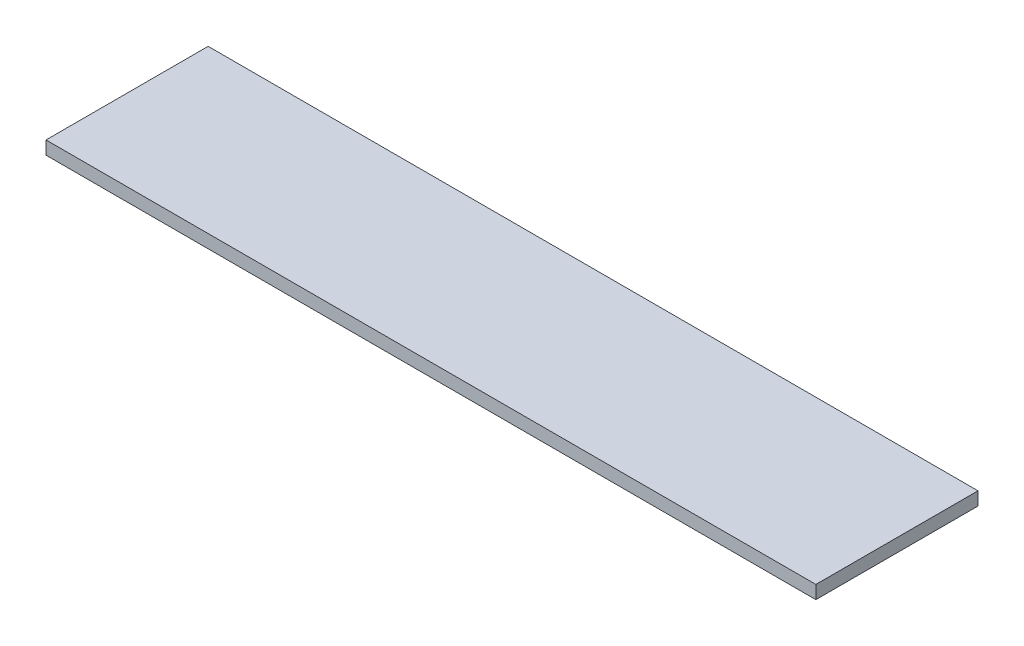
from build123d import *

# Parameters (mm, degrees)
SKETCH_1_W      = 569.770649127
SKETCH_1_H      = 9.782099076
EXTRUDE_1_DEPTH = 120


with BuildPart() as part:
    # Эскиз1 → Бобышка-Вытянуть1 (new body)
    with BuildSketch(Plane.XY):
        with Locations((81.756610091, 23.447598423)):
            Rectangle(SKETCH_1_W, SKETCH_1_H)
    extrude(amount=EXTRUDE_1_DEPTH)


solid = part.part
